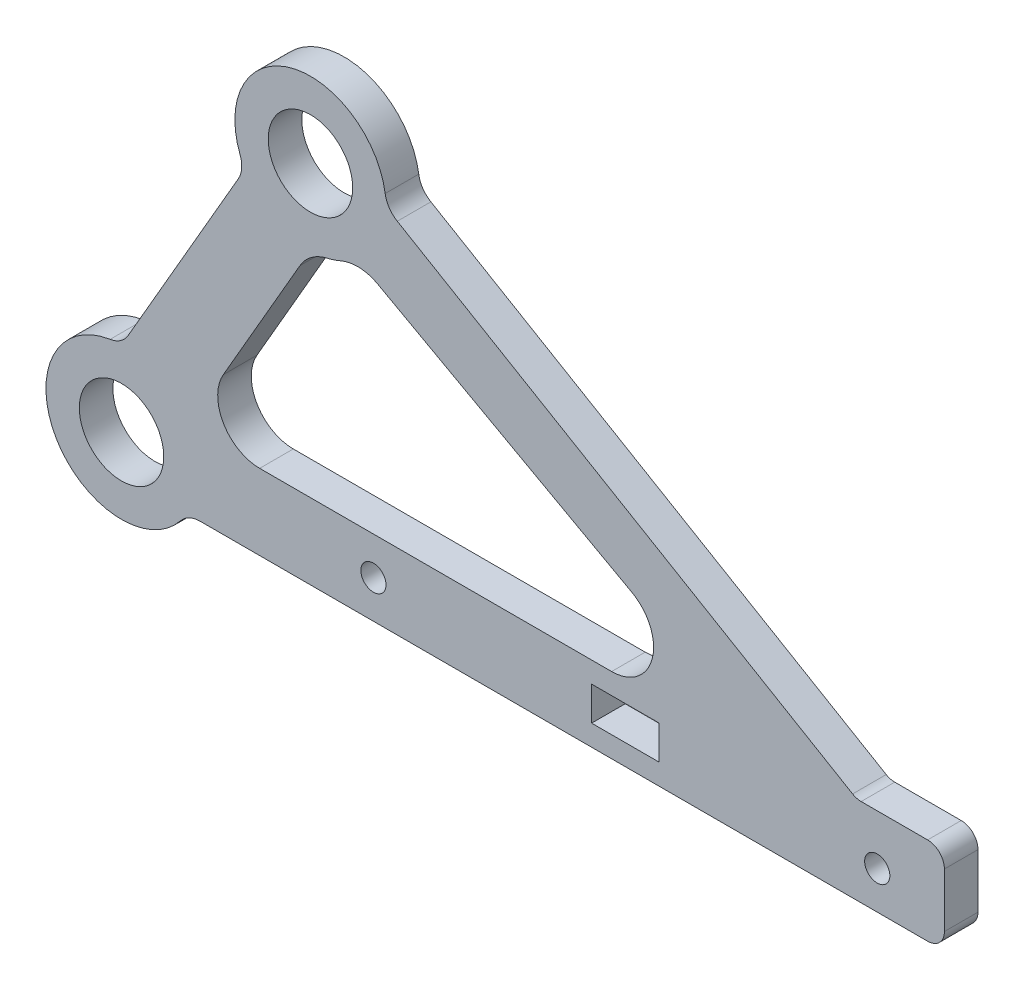
from build123d import *

# Parameters (mm, degrees)
SKETCH_1_R      = 5.03
SKETCH_1_R_2    = 1.5
SKETCH_1_W      = 8.03
SKETCH_1_H      = 4.03
EXTRUDE_1_DEPTH = 4


with BuildPart() as part:
    # 草图1 → 凸台-拉伸1 (new body)
    with BuildSketch(Plane.XY):
        with BuildLine():
            Line((87, -4.5), (9.367496998, -4.5))
            ThreePointArc((9.367496998, -4.5), (8.068458892, -4.795836543), (7.025622748, -5.625))
            ThreePointArc((7.025622748, -5.625), (-7.794228634, -4.5), (-1.358581522, 8.896867777))
            ThreePointArc((-1.358581522, 8.896867777), (-0.119086833, 9.385408641), (0.786634182, 10.36249037))
            Line((0.786634182, 10.36249037), (13.919137184, 33.108652801))
            ThreePointArc((13.919137184, 33.108652801), (14.312454275, 34.381571072), (14.11579573, 35.699275393))
            ThreePointArc((14.11579573, 35.699275393), (20.177098522, 47.666206639), (31.398879943, 40.316481698))
            ThreePointArc((31.398879943, 40.316481698), (31.879352208, 39.085435776), (32.842164256, 38.180272466))
            Line((32.842164256, 38.180272466), (87.068435314, 6.227425402))
            ThreePointArc((87.068435314, 6.227425402), (87.55756519, 6.02099445), (88.083774649, 5.950529007))
            Line((88.083774649, 5.950529007), (96, 5.950529007))
            ThreePointArc((96, 5.950529007), (97.414213562, 5.364742569), (98, 3.950529007))
            Line((98, 3.950529007), (98, 0))
            Line((98, 0), (98, -2.5))
            ThreePointArc((98, -2.5), (97.414213562, -3.914213562), (96, -4.5))
            Line((96, -4.5), (87, -4.5))
        make_face()
        Circle(SKETCH_1_R, mode=Mode.SUBTRACT)
        with Locations((22.5, 38.97114317)):
            Circle(SKETCH_1_R, mode=Mode.SUBTRACT)
        with Locations((30, 0)):
            Circle(SKETCH_1_R_2, mode=Mode.SUBTRACT)
        with Locations((90, 0)):
            Circle(SKETCH_1_R_2, mode=Mode.SUBTRACT)
        with Locations((60, 0)):
            Rectangle(SKETCH_1_W, SKETCH_1_H, mode=Mode.SUBTRACT)
        with BuildLine():
            Line((21.255373367, 27.815386605), (12.124355653, 12))
            ThreePointArc((12.124355653, 12), (12.124355653, 7), (16.454482672, 4.5))
            Line((16.454482672, 4.5), (58.367468971, 4.5))
            ThreePointArc((58.367468971, 4.5), (63.210197148, 8.25582003), (60.777559131, 13.880806481))
            Line((60.777559131, 13.880806481), (30.521886072, 30.525892321))
            ThreePointArc((30.521886072, 30.525892321), (28.338019103, 31.139965525), (26.107583087, 30.725820601))
            ThreePointArc((26.107583087, 30.725820601), (25.308251431, 30.420486827), (24.483535962, 30.192442521))
            ThreePointArc((24.483535962, 30.192442521), (22.620790776, 29.341612745), (21.255373367, 27.815386605))
        make_face(mode=Mode.SUBTRACT)
    extrude(amount=EXTRUDE_1_DEPTH)


solid = part.part
